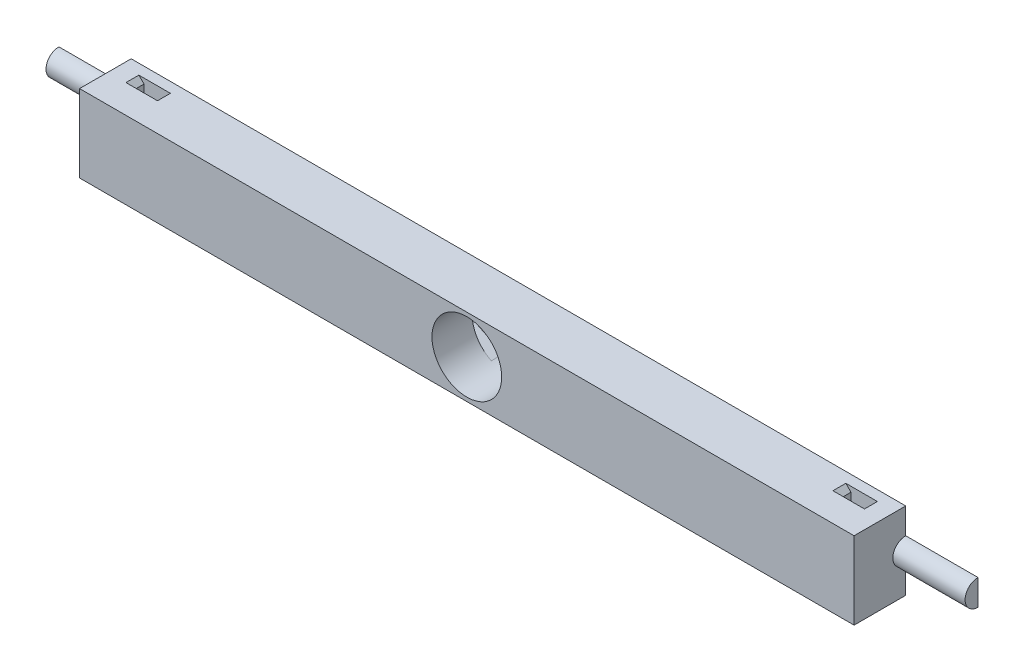
from build123d import *

# Parameters (mm, degrees)
SKETCH_1_W           = 300
SKETCH_1_H           = 30
EXTRUDE_1_DEPTH      = 20
EXTRUDE_2_DEPTH      = 28
EXTRUDE_2_DEPTH_BACK = 328
SKETCH_3_R           = 4
CUT_EXTRUDE_1_DEPTH  = 182.614977356
SKETCH_3_3_R         = 6
SKETCH_3_3_R_2       = 4
CUT_EXTRUDE_2_DEPTH  = 182.614977356
SKETCH_3_4_R         = 13.5
SKETCH_3_4_R_2       = 6
CUT_EXTRUDE_3_DEPTH  = 182.614977356
SKETCH_3_5_R         = 2.4
CUT_EXTRUDE_4_DEPTH  = 4.5
SKETCH_3_6_R         = 2.4
CUT_EXTRUDE_5_DEPTH  = 5
SKETCH_9_W           = 8.22
SKETCH_9_H           = 5
CUT_EXTRUDE_6_DEPTH  = 182.295339172
CUT_EXTRUDE_7_REACH  = 183.615
SKETCH_11_R          = 2.55


with BuildPart() as part:
    # 草图1 → 凸台-拉伸1 (new body)
    with BuildSketch(Plane.XY):
        with Locations((0, 15)):
            Rectangle(SKETCH_1_W, SKETCH_1_H)
    extrude(amount=EXTRUDE_1_DEPTH)

    # 草图2 → 凸台-拉伸2 (add, two sides: drawn at the far end of the back side and taken through both)
    with BuildSketch(Plane.ZY.offset(150).offset(-EXTRUDE_2_DEPTH_BACK)):
        with BuildLine():
            Line((0, 20), (0, 10))
            ThreePointArc((0, 10), (5, 15), (0, 20))
        make_face()
    extrude(amount=EXTRUDE_2_DEPTH + EXTRUDE_2_DEPTH_BACK)

    # 草图3 → 切除-拉伸1 (cut, through all)
    with BuildSketch(Plane(origin=(0, 0, 0), x_dir=(-1, 0, 0), z_dir=(0, 0, -1))):
        with Locations((0, 15)):
            Circle(SKETCH_3_R)
    extrude(amount=-CUT_EXTRUDE_1_DEPTH, mode=Mode.SUBTRACT)

    # 草图3<3> → 切除-拉伸2 (cut, through all)
    with BuildSketch(Plane(origin=(0, 0, 0), x_dir=(-1, 0, 0), z_dir=(0, 0, -1))):
        with Locations((0, 15)):
            Circle(SKETCH_3_3_R)
        with Locations((0, 15)):
            Circle(SKETCH_3_3_R_2, mode=Mode.SUBTRACT)
    extrude(amount=-CUT_EXTRUDE_2_DEPTH, mode=Mode.SUBTRACT)

    # 草图3<4> → 切除-拉伸3 (cut, through all)
    with BuildSketch(Plane(origin=(0, 0, 0), x_dir=(-1, 0, 0), z_dir=(0, 0, -1))):
        with Locations((0, 15)):
            Circle(SKETCH_3_4_R)
        with Locations((0, 15)):
            Circle(SKETCH_3_4_R_2, mode=Mode.SUBTRACT)
    extrude(amount=-CUT_EXTRUDE_3_DEPTH, mode=Mode.SUBTRACT)

    # 草图3<5> → 切除-拉伸4 (cut)
    # profile 1 of 2: a face of its own
    with BuildSketch(Plane(origin=(0, 0, 0), x_dir=(-1, 0, 0), z_dir=(0, 0, -1))):
        with BuildLine():
            ThreePointArc((-6.02027027, 2.916691435), (-13.5, 15), (-6.02027027, 27.083308565))
            Line((-6.02027027, 27.083308565), (-20.841216216, 19.699064442))
            ThreePointArc((-20.841216216, 19.699064442), (-23.75, 15), (-20.841216216, 10.300935558))
            Line((-20.841216216, 10.300935558), (-6.02027027, 2.916691435))
        make_face()
        with Locations((-18.5, 15)):
            Circle(SKETCH_3_5_R, mode=Mode.SUBTRACT)
    # profile 2 of 2: a face of its own
    with BuildSketch(Plane(origin=(0, 0, 0), x_dir=(-1, 0, 0), z_dir=(0, 0, -1))):
        with BuildLine():
            Line((20.841216216, 19.699064442), (6.02027027, 27.083308565))
            ThreePointArc((6.02027027, 27.083308565), (13.5, 15), (6.02027027, 2.916691435))
            Line((6.02027027, 2.916691435), (20.841216216, 10.300935558))
            ThreePointArc((20.841216216, 10.300935558), (23.75, 15), (20.841216216, 19.699064442))
        make_face()
        with Locations((18.5, 15)):
            Circle(SKETCH_3_5_R, mode=Mode.SUBTRACT)
    extrude(amount=-CUT_EXTRUDE_4_DEPTH, mode=Mode.SUBTRACT)

    # 草图3<6> → 切除-拉伸5 (cut)
    with BuildSketch(Plane(origin=(0, 0, 0), x_dir=(-1, 0, 0), z_dir=(0, 0, -1))):
        with Locations((18.5, 15)):
            Circle(SKETCH_3_6_R)
        with Locations((-18.5, 15)):
            Circle(SKETCH_3_6_R)
    extrude(amount=-CUT_EXTRUDE_5_DEPTH, mode=Mode.SUBTRACT)

    # 草图6 → 切除-放样2 section 0
    with BuildSketch(Plane.XZ):
        with BuildLine():
            Line((-143.03, 4), (-130.81, 4))
            Line((-130.81, 4), (-130.81, 9))
            Line((-130.81, 9), (-143.03, 9))
            Line((-143.03, 9), (-143.03, 4))
        make_face()
    # 草图7 → 切除-放样2 section 1
    with BuildSketch(Plane(origin=(0, 2, 0), x_dir=(-1, 0, 0), z_dir=(0, -1, 0))):
        with BuildLine():
            Line((132.81, -9), (141.03, -9))
            Line((141.03, -9), (141.03, -4))
            Line((141.03, -4), (132.81, -4))
            Line((132.81, -4), (132.81, -9))
        make_face()
    loft_2 = loft(mode=Mode.SUBTRACT)

    # 草图4 → 切除-放样3 section 0
    with BuildSketch(Plane(origin=(0, 30, 0), x_dir=(1, 0, 0), z_dir=(0, 1, 0))):
        with BuildLine():
            Line((-143.03, -9), (-130.81, -9))
            Line((-130.81, -9), (-130.81, -4))
            Line((-130.81, -4), (-143.03, -4))
            Line((-143.03, -4), (-143.03, -9))
        make_face()
    # 草图5 → 切除-放样3 section 1
    with BuildSketch(Plane(origin=(0, 28, 0), x_dir=(1, 0, 0), z_dir=(0, 1, 0))):
        with BuildLine():
            Line((-141.03, -9), (-132.81, -9))
            Line((-132.81, -9), (-132.81, -4))
            Line((-132.81, -4), (-141.03, -4))
            Line((-141.03, -4), (-141.03, -9))
        make_face()
    loft_3 = loft(mode=Mode.SUBTRACT)

    # 草图9 → 切除-拉伸6 (cut, through all)
    with BuildSketch(Plane(origin=(0, 28, 0), x_dir=(1, 0, 0), z_dir=(0, 1, 0))):
        with Locations((-136.92, -6.5)):
            Rectangle(SKETCH_9_W, SKETCH_9_H)
    cut_extrude_6 = extrude(amount=-CUT_EXTRUDE_6_DEPTH, mode=Mode.SUBTRACT)

    # 镜向2: 切除-放样2, 切除-放样3, 切除-拉伸6 across plane
    add(loft_2.mirror(Plane(origin=(0, 0, 0), x_dir=(0, 0, 1), z_dir=(1, 0, 0))), mode=Mode.SUBTRACT)
    add(loft_3.mirror(Plane(origin=(0, 0, 0), x_dir=(0, 0, 1), z_dir=(1, 0, 0))), mode=Mode.SUBTRACT)
    add(cut_extrude_6.mirror(Plane(origin=(0, 0, 0), x_dir=(0, 0, 1), z_dir=(1, 0, 0))), mode=Mode.SUBTRACT)

    # 草图11 → 切除-拉伸7 (cut, up to next)
    with BuildSketch(Plane(origin=(0, 0, 0), x_dir=(-1, 0, 0), z_dir=(0, 0, -1)), mode=Mode.PRIVATE) as cut_extrude_7_sk1:
        with Locations((-136.92, 15)):
            Circle(SKETCH_11_R)
    cut_extrude_7_tool1 = extrude(cut_extrude_7_sk1.sketch, amount=-CUT_EXTRUDE_7_REACH, mode=Mode.PRIVATE) & part.part
    cut_extrude_7 = cut_extrude_7_tool1.solids().sort_by_distance((136.92, 15, 0))[0]
    add(cut_extrude_7, mode=Mode.SUBTRACT)

    # 镜向3: 切除-拉伸7 across plane
    add(cut_extrude_7.mirror(Plane(origin=(0, 0, 0), x_dir=(0, 0, 1), z_dir=(1, 0, 0))), mode=Mode.SUBTRACT)


solid = part.part
